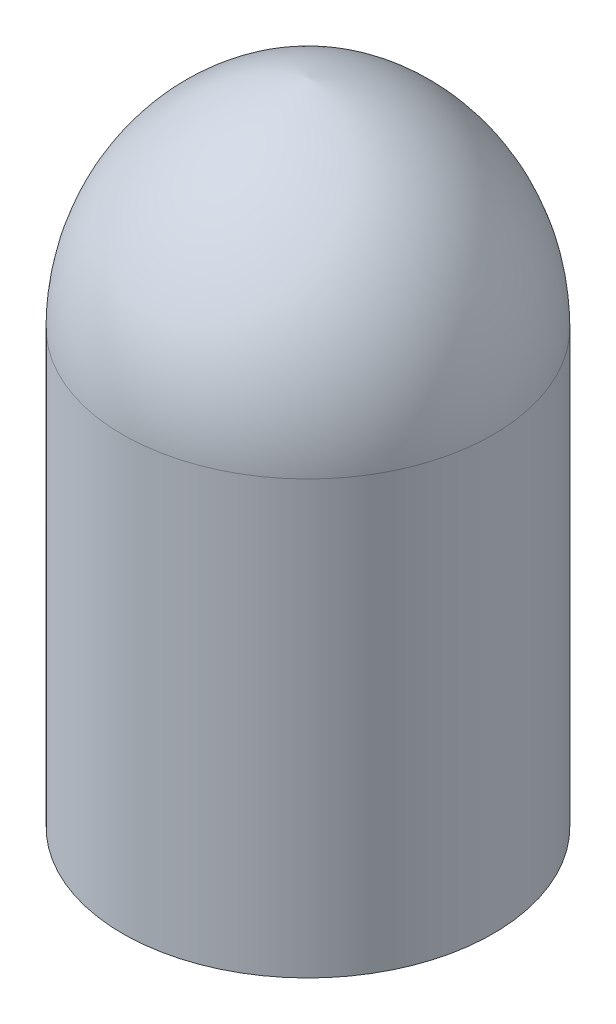
from build123d import *

# Parameters (mm, degrees)
SHELL3_T = -2


with BuildPart() as part:
    # Sketch1 → Revolve2 (revolve)
    with BuildSketch(Plane.XY, mode=Mode.PRIVATE) as revolve2_sk:
        with BuildLine():
            Line((0, 0), (60, 0))
            Line((60, 0), (60, 140))
            ThreePointArc((60, 140), (42.947342668, 186.097722286), (0, 210))
            Line((0, 210), (0, 0))
        make_face()
    revolve(revolve2_sk.sketch.rotate(Axis((0, 210, 0), (0, -1, 0)), 180), axis=Axis((0, 210, 0), (0, -1, 0)))

    # Shell3
    shell3_openings = [part.faces().sort_by_distance(p)[0] for p in [
        (0, 0, 0),
    ]]
    offset(amount=SHELL3_T, openings=shell3_openings, kind=Kind.INTERSECTION)


solid = part.part
